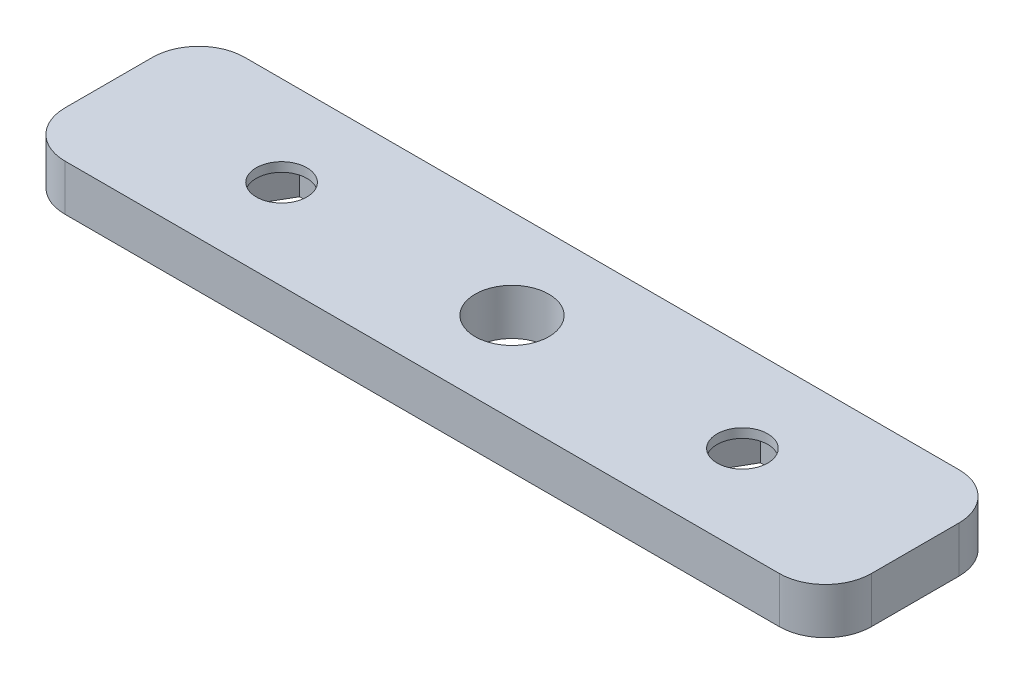
from build123d import *

# Parameters (mm, degrees)
CROQUIS1_W                 = 70
CROQUIS1_H                 = 15.6
SALIENTE_EXTRUIR1_DEPTH    = 4
CORTAR_EXTRUIR2_DEPTH      = 37.081019941
CORTAR_EXTRUIR2_DEPTH_BACK = 37.081019941
CROQUIS3_R                 = 3.2
CROQUIS3_R_2               = 2.2
REDONDEO1_R                = 4
CORTAR_EXTRUIR4_DEPTH      = 3.2


with BuildPart() as part:
    # Croquis1 → Saliente-Extruir1 (new body)
    with BuildSketch(Plane(origin=(0, 0, 0), x_dir=(1, 0, 0), z_dir=(0, 1, 0))):
        Rectangle(CROQUIS1_W, CROQUIS1_H)
    extrude(amount=SALIENTE_EXTRUIR1_DEPTH)

    # Croquis3 → Cortar-Extruir2 (cut, two sides: drawn at the far end of the back side and taken through both)
    with BuildSketch(Plane(origin=(0, 0, 0), x_dir=(1, 0, 0), z_dir=(0, 1, 0)).offset(-CORTAR_EXTRUIR2_DEPTH_BACK)):
        with Locations(Location((0, 0, 0), (0, 0, 90))):
            Circle(CROQUIS3_R)
        with Locations(Location((20, 0, 0), (0, 0, 90))):
            Circle(CROQUIS3_R_2)
        with Locations(Location((-20, 0, 0), (0, 0, 90))):
            Circle(CROQUIS3_R_2)
    extrude(amount=CORTAR_EXTRUIR2_DEPTH + CORTAR_EXTRUIR2_DEPTH_BACK, mode=Mode.SUBTRACT)

    # Redondeo1
    redondeo1_edges = [part.edges().sort_by_distance(p)[0] for p in [
        (35, 2, 7.8),
        (-35, 2, 7.8),
        (-35, 2, -7.8),
        (35, 2, -7.8),
    ]]
    fillet(redondeo1_edges, radius=REDONDEO1_R)

    # Croquis5 → Cortar-Extruir4 (cut)
    with BuildSketch(Plane(origin=(0, 0, 0), x_dir=(1, 0, 0), z_dir=(0, 1, 0))):
        Polygon((-15.727608008, 0), (-17.863804004, 3.7), (-22.136195996, 3.7), (-24.272391992, 0), (-22.136195996, -3.7), (-17.863804004, -3.7), align=None)
        Polygon((17.863804004, -3.7), (15.727608008, 0), (17.863804004, 3.7), (22.136195996, 3.7), (24.272391992, 0), (22.136195996, -3.7), align=None)
    extrude(amount=CORTAR_EXTRUIR4_DEPTH, mode=Mode.SUBTRACT)


solid = part.part
